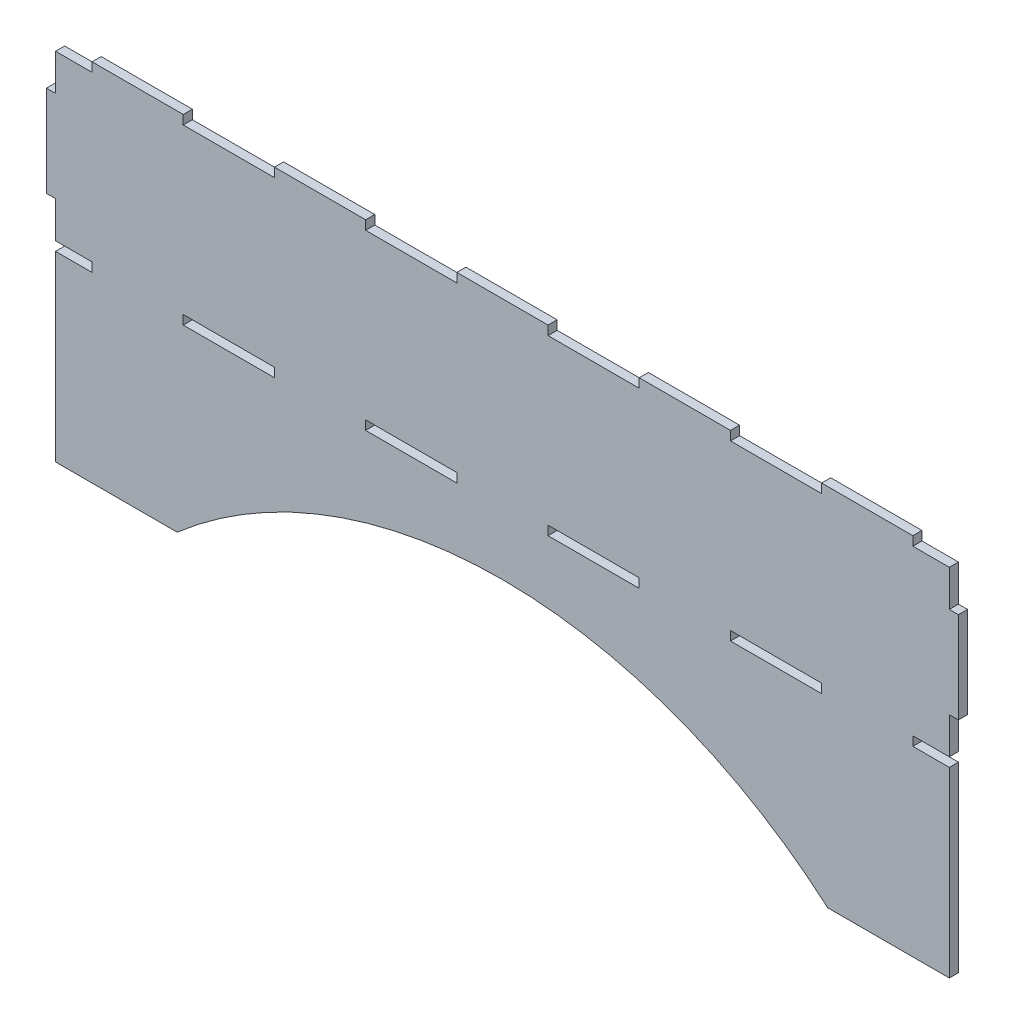
from build123d import *

# Parameters (mm, degrees)
SKETCH1_W           = 300
SKETCH1_H           = 60
BOSS_EXTRUDE1_DEPTH = 3
SKETCH3_W           = 300
SKETCH3_H           = 60
BOSS_EXTRUDE2_DEPTH = 3
SKETCH2_W           = 30
SKETCH2_H           = 3
CUT_EXTRUDE6_DEPTH  = 5
SKETCH4_W           = 3
SKETCH4_H           = 60
CUT_EXTRUDE7_DEPTH  = 5


with BuildPart() as part:
    # Sketch1 → Boss-Extrude1 (new body)
    with BuildSketch(Plane.XY):
        with Locations((150, 30)):
            Rectangle(SKETCH1_W, SKETCH1_H)
    extrude(amount=BOSS_EXTRUDE1_DEPTH)

    # Sketch3 → Boss-Extrude2 (add)
    with BuildSketch(Plane.XY.offset(3)):
        with Locations((150, -30)):
            Rectangle(SKETCH3_W, SKETCH3_H)
    extrude(amount=-BOSS_EXTRUDE2_DEPTH)

    # Sketch2 → Cut-Extrude6 (cut)
    with BuildSketch(Plane.XY.offset(3)):
        Polygon((15, 0), (15, 3), (3, 3), (3, 15), (0, 15), (0, 0), align=None)
        with Locations((60, 1.5)):
            Rectangle(SKETCH2_W, SKETCH2_H)
        with Locations((120, 1.5)):
            Rectangle(SKETCH2_W, SKETCH2_H)
        with Locations((180, 1.5)):
            Rectangle(SKETCH2_W, SKETCH2_H)
        with Locations((240, 1.5)):
            Rectangle(SKETCH2_W, SKETCH2_H)
        Polygon((300, 0), (300, 15), (297, 15), (297, 3), (285, 3), (285, 0), align=None)
        Polygon((300, 45), (300, 60), (285, 60), (285, 57), (297, 57), (297, 45), align=None)
        with Locations((240, 58.5)):
            Rectangle(SKETCH2_W, SKETCH2_H)
        with Locations((180, 58.5)):
            Rectangle(SKETCH2_W, SKETCH2_H)
        with Locations((120, 58.5)):
            Rectangle(SKETCH2_W, SKETCH2_H)
        with Locations((60, 58.5)):
            Rectangle(SKETCH2_W, SKETCH2_H)
        Polygon((0, 60), (0, 45), (3, 45), (3, 57), (15, 57), (15, 60), align=None)
    extrude(amount=-CUT_EXTRUDE6_DEPTH, mode=Mode.SUBTRACT)

    # Sketch4 → Cut-Extrude7 (cut)
    with BuildSketch(Plane.XY.offset(3)):
        with Locations((1.5, -30)):
            Rectangle(SKETCH4_W, SKETCH4_H)
        with Locations((298.5, -30)):
            Rectangle(SKETCH4_W, SKETCH4_H)
        with BuildLine():
            Line((43, -60), (257, -60))
            ThreePointArc((257, -60), (150, -20), (43, -60))
        make_face()
    extrude(amount=-CUT_EXTRUDE7_DEPTH, mode=Mode.SUBTRACT)


solid = part.part
